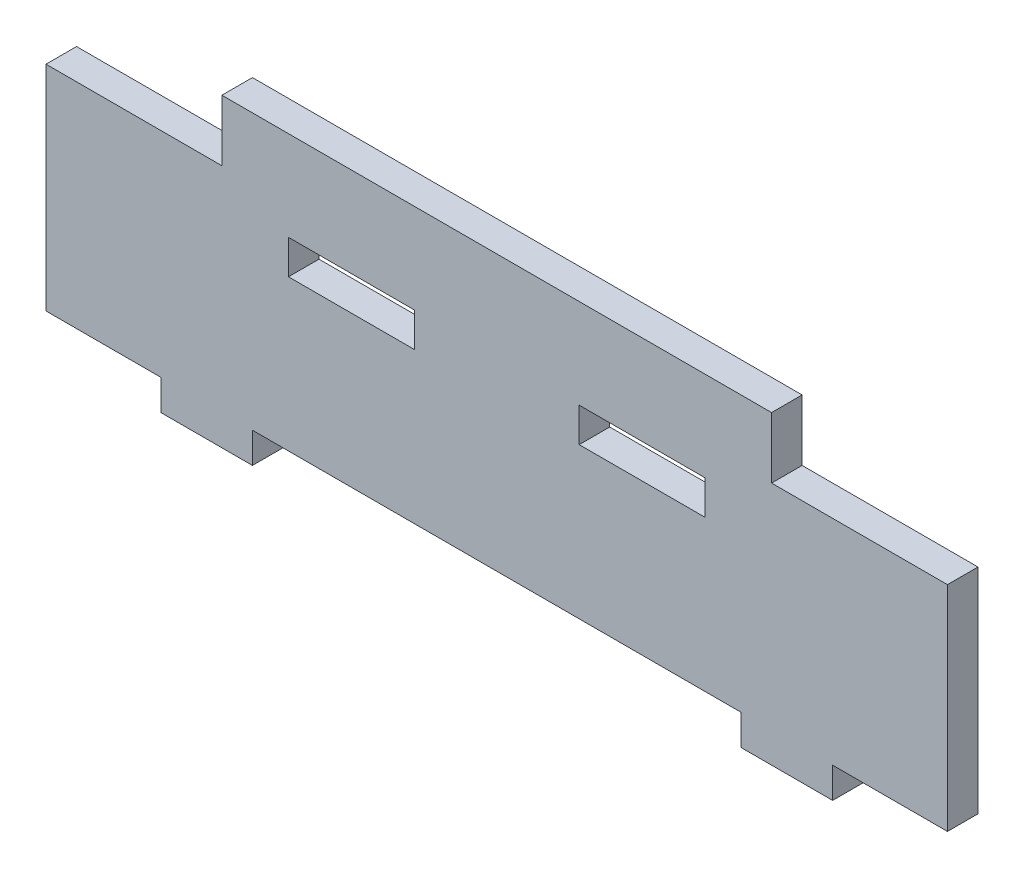
from build123d import *

# Parameters (mm, degrees)
SKETCH1_W           = 20.6
SKETCH1_H           = 5.6
BOSS_EXTRUDE1_DEPTH = 5


with BuildPart() as part:
    # Sketch1 → Boss-Extrude1 (new body)
    with BuildSketch(Plane.XY):
        Polygon((28.8, 35), (0, 35), (0, 0), (18.8, 0), (18.8, -5), (33.8, -5), (33.8, 0), (113.8, 0), (113.8, -5), (128.8, -5), (128.8, 0), (147.6, 0), (147.6, 35), (118.8, 35), (118.8, 45), (28.8, 45), align=None)
        with Locations((50, 27.5)):
            Rectangle(SKETCH1_W, SKETCH1_H, mode=Mode.SUBTRACT)
        with Locations((97.6, 27.5)):
            Rectangle(SKETCH1_W, SKETCH1_H, mode=Mode.SUBTRACT)
    extrude(amount=BOSS_EXTRUDE1_DEPTH)


solid = part.part
